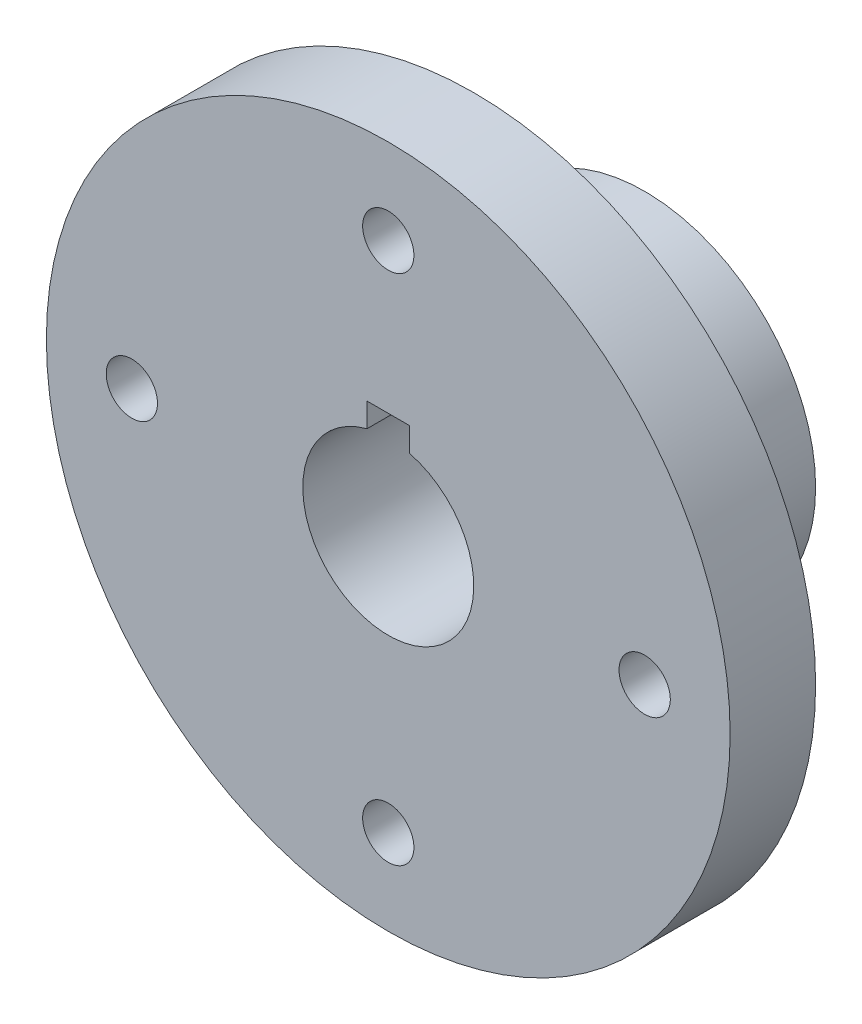
from build123d import *

# Parameters (mm, degrees)
SKETCH1_R           = 200
BOSS_EXTRUDE1_DEPTH = 50
SKETCH3_R           = 100
BOSS_EXTRUDE2_DEPTH = 100
SKETCH4_R           = 15
CUT_EXTRUDE1_DEPTH  = 100
SKETCH5_R           = 50
CUT_EXTRUDE2_DEPTH  = 321.156211872
SKETCH6_W           = 25
SKETCH6_H           = 25
CUT_EXTRUDE3_DEPTH  = 321.156211872


with BuildPart() as part:
    # Sketch1 → Boss-Extrude1 (new body)
    with BuildSketch(Plane.XY):
        Circle(SKETCH1_R)
    extrude(amount=BOSS_EXTRUDE1_DEPTH)

    # Sketch3 → Boss-Extrude2 (add)
    with BuildSketch(Plane(origin=(0, 0, 0), x_dir=(-1, 0, 0), z_dir=(0, 0, -1))):
        with Locations(Location((0, 0, 0), (0, 0, 180))):
            Circle(SKETCH3_R)
    extrude(amount=BOSS_EXTRUDE2_DEPTH)

    # Sketch4 → Cut-Extrude1 (cut)
    with BuildSketch(Plane.XY.offset(50)):
        with Locations((0, 150)):
            Circle(SKETCH4_R)
        with Locations((150, 0)):
            Circle(SKETCH4_R)
        with Locations((0, -150)):
            Circle(SKETCH4_R)
        with Locations((-150, 0)):
            Circle(SKETCH4_R)
    extrude(amount=-CUT_EXTRUDE1_DEPTH, mode=Mode.SUBTRACT)

    # Sketch5 → Cut-Extrude2 (cut, through all)
    with BuildSketch(Plane.XY.offset(50)):
        Circle(SKETCH5_R)
    extrude(amount=-CUT_EXTRUDE2_DEPTH, mode=Mode.SUBTRACT)

    # Sketch6 → Cut-Extrude3 (cut, through all)
    with BuildSketch(Plane.XY.offset(50)):
        with Locations((0, 50)):
            Rectangle(SKETCH6_W, SKETCH6_H)
    extrude(amount=-CUT_EXTRUDE3_DEPTH, mode=Mode.SUBTRACT)


solid = part.part
